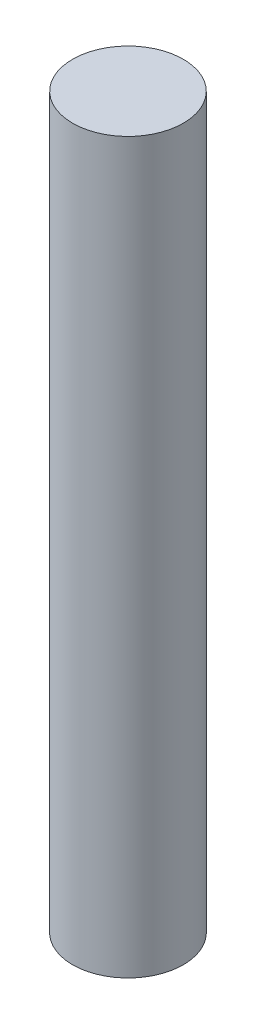
from build123d import *

# Parameters (mm, degrees)
SKETCH1_R           = 4.826
BOSS_EXTRUDE1_DEPTH = 63.5


with BuildPart() as part:
    # Sketch1 → Boss-Extrude1 (new body)
    with BuildSketch(Plane(origin=(0, 0, 0), x_dir=(1, 0, 0), z_dir=(0, 1, 0))):
        with Locations(Location((0, 0, 0), (0, 0, 270))):
            Circle(SKETCH1_R)
    extrude(amount=BOSS_EXTRUDE1_DEPTH)


solid = part.part
